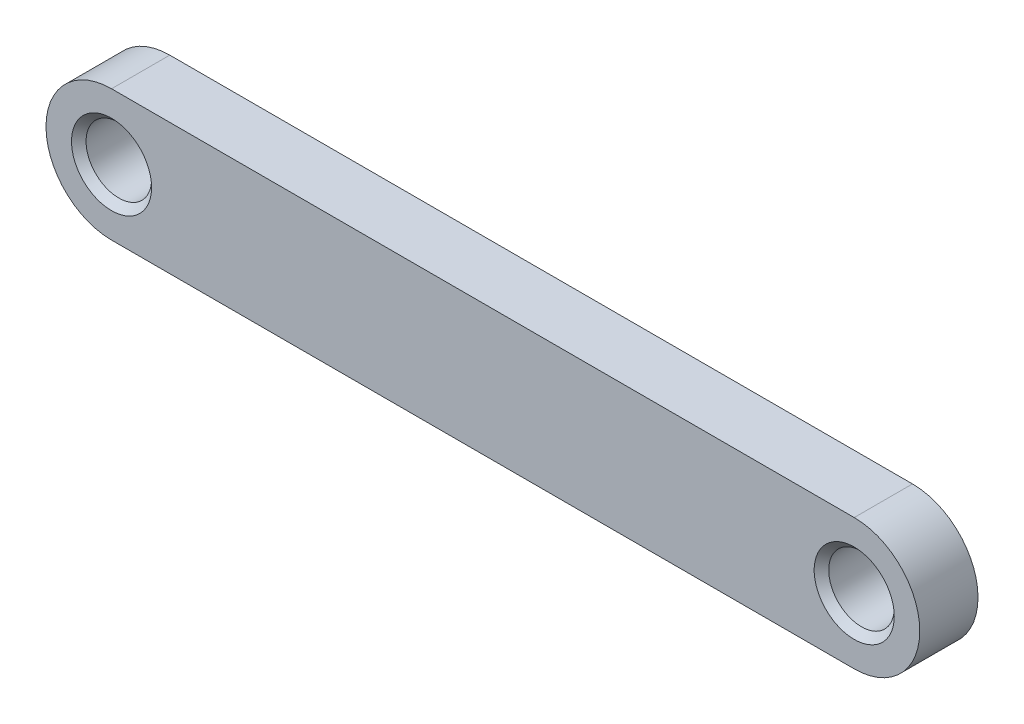
from build123d import *

# Parameters (mm, degrees)
SKETCH1_R           = 4.5
BOSS_EXTRUDE1_DEPTH = 8
CHAMFER1_SIZE       = 1


with BuildPart() as part:
    # Sketch1 → Boss-Extrude1 (new body)
    with BuildSketch(Plane.XY):
        with BuildLine():
            Line((0, 9), (102, 9))
            ThreePointArc((102, 9), (111, 0), (102, -9))
            Line((102, -9), (0, -9))
            ThreePointArc((0, -9), (-9, 0), (0, 9))
        make_face()
        Circle(SKETCH1_R, mode=Mode.SUBTRACT)
        with Locations((102, 0)):
            Circle(SKETCH1_R, mode=Mode.SUBTRACT)
    extrude(amount=BOSS_EXTRUDE1_DEPTH)

    # Chamfer1
    chamfer1_edges = [part.edges().sort_by_distance(p)[0] for p in [
        (-4.5, 0, 8),
        (97.5, 0, 8),
    ]]
    chamfer(chamfer1_edges, length=CHAMFER1_SIZE)


solid = part.part
